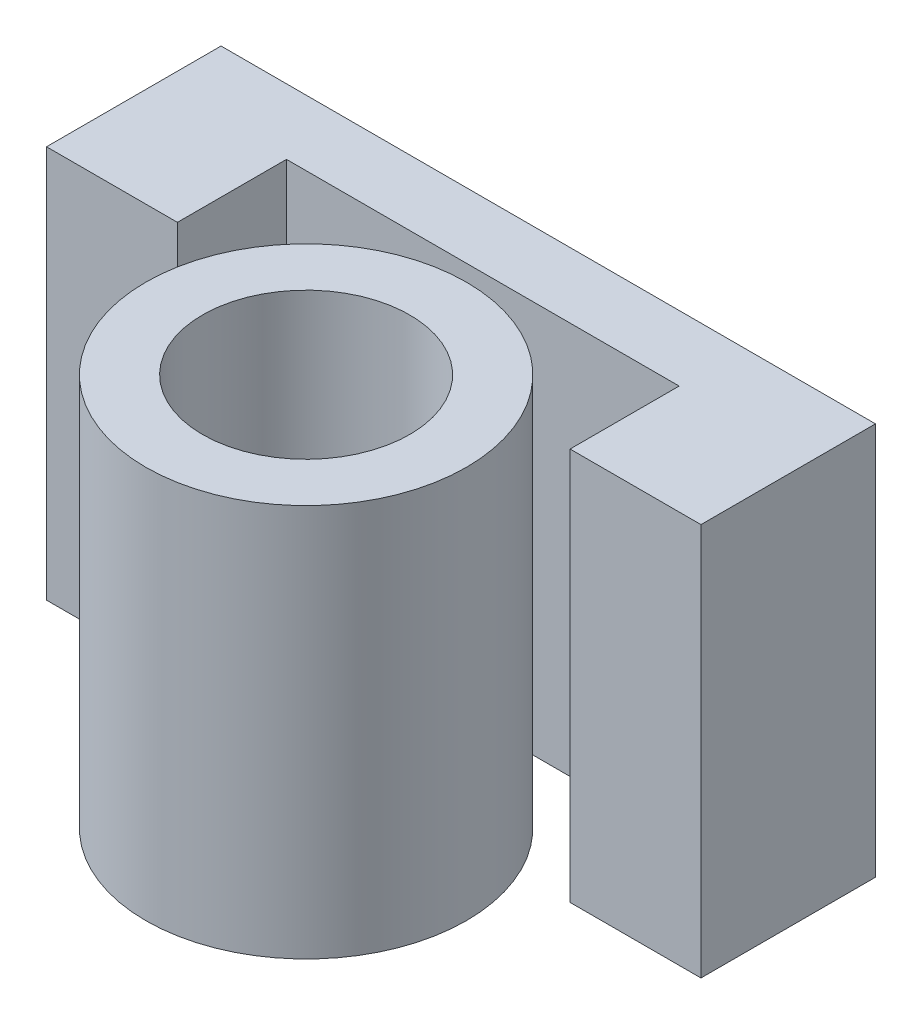
from build123d import *

# Parameters (mm, degrees)
SKETCH1_R             = 7.35
SKETCH1_R_2           = 4.75
BOSS_EXTRUDE1_DEPTH   = 18
BOSS_EXTRUDE1_2_DEPTH = 18


with BuildPart() as part:
    # Sketch1 → Boss-Extrude1 (new body)
    with BuildSketch(Plane(origin=(0, 0, 0), x_dir=(1, 0, 0), z_dir=(0, 1, 0))):
        with Locations(Location((0, 0, 0), (0, 0, 270))):
            Circle(SKETCH1_R)
        with Locations(Location((0, 0, 0), (0, 0, 270))):
            Circle(SKETCH1_R_2, mode=Mode.SUBTRACT)
    extrude(amount=BOSS_EXTRUDE1_DEPTH)


with BuildPart() as body_2:
    # Sketch1 → Boss-Extrude1 2 (new body)
    with BuildSketch(Plane(origin=(0, 0, 0), x_dir=(1, 0, 0), z_dir=(0, 1, 0))):
        Polygon((-15, 3.1), (-9, 3.1), (-9, 8.1), (9, 8.1), (9, 3.1), (15, 3.1), (15, 11.1), (-15, 11.1), align=None)
    extrude(amount=BOSS_EXTRUDE1_2_DEPTH)


solid = Compound([part.part, body_2.part])
